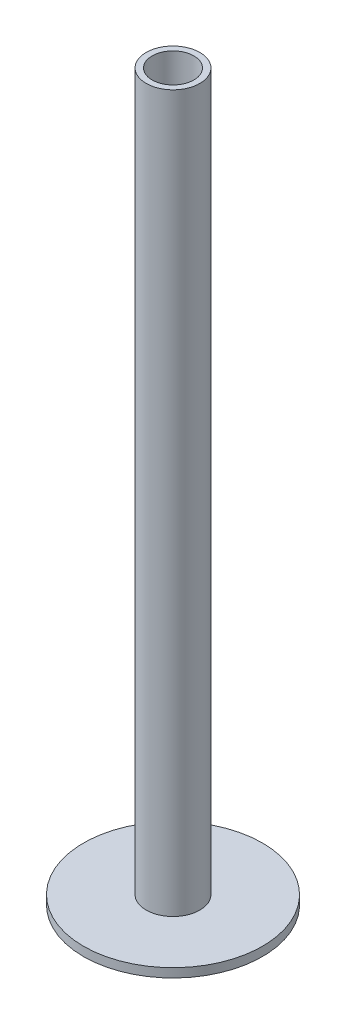
from build123d import *
from build123d.topology import SkipClean

# Parameters (mm, degrees)
SKETCH1_R           = 9
SKETCH1_R_2         = 7
BOSS_EXTRUDE1_DEPTH = 240
BOSS_EXTRUDE2_START = 3
SKETCH2_R           = 30
SKETCH2_R_2         = 7
BOSS_EXTRUDE2_DEPTH = 3


with BuildPart() as part:
    # Sketch1 → Boss-Extrude1 (new body)
    with BuildSketch(Plane(origin=(0, 0, 0), x_dir=(1, 0, 0), z_dir=(0, 1, 0))):
        with Locations(Location((0, 0, 0), (0, 0, 270))):
            Circle(SKETCH1_R)
        with Locations(Location((0, 0, 0), (0, 0, 270))):
            Circle(SKETCH1_R_2, mode=Mode.SUBTRACT)
    extrude(amount=BOSS_EXTRUDE1_DEPTH)

    # Sketch2 → Boss-Extrude2 (add)
    with SkipClean():  # the faces are left unmerged after this step: merging them gives an invalid solid
        with BuildSketch(Plane.XZ.offset(BOSS_EXTRUDE2_START)):
            with Locations(Location((0, 0, 0), (0, 0, 270))):
                Circle(SKETCH2_R)
            with Locations(Location((0, 0, 0), (0, 0, 270))):
                Circle(SKETCH2_R_2, mode=Mode.SUBTRACT)
        extrude(amount=-BOSS_EXTRUDE2_DEPTH)


solid = part.part
